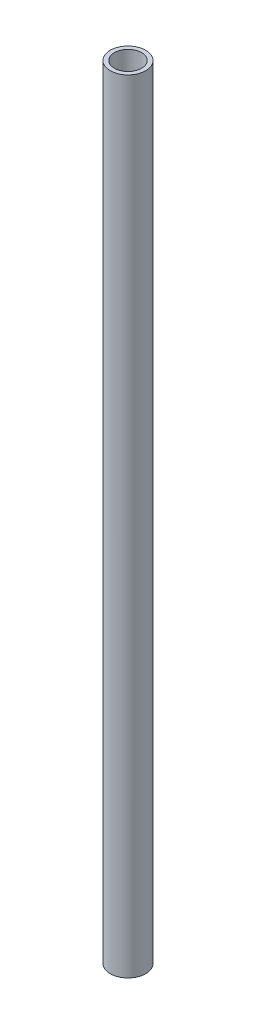
from build123d import *

# Parameters (mm, degrees)
BOSS_EXTRUDE1_START = -140.085761
SKETCH1_R           = 6.35
SKETCH1_R_2         = 4.8768
BOSS_EXTRUDE1_DEPTH = 280.171522


with BuildPart() as part:
    # Sketch1 → Boss-Extrude1 (new body)
    with BuildSketch(Plane(origin=(0, 0, 0), x_dir=(1, 0, 0), z_dir=(0, 1, 0)).offset(BOSS_EXTRUDE1_START)):
        with Locations(Location((0, 0, 0), (0, 0, 180))):
            Circle(SKETCH1_R)
        with Locations(Location((0, 0, 0), (0, 0, 180))):
            Circle(SKETCH1_R_2, mode=Mode.SUBTRACT)
    extrude(amount=BOSS_EXTRUDE1_DEPTH)


solid = part.part
